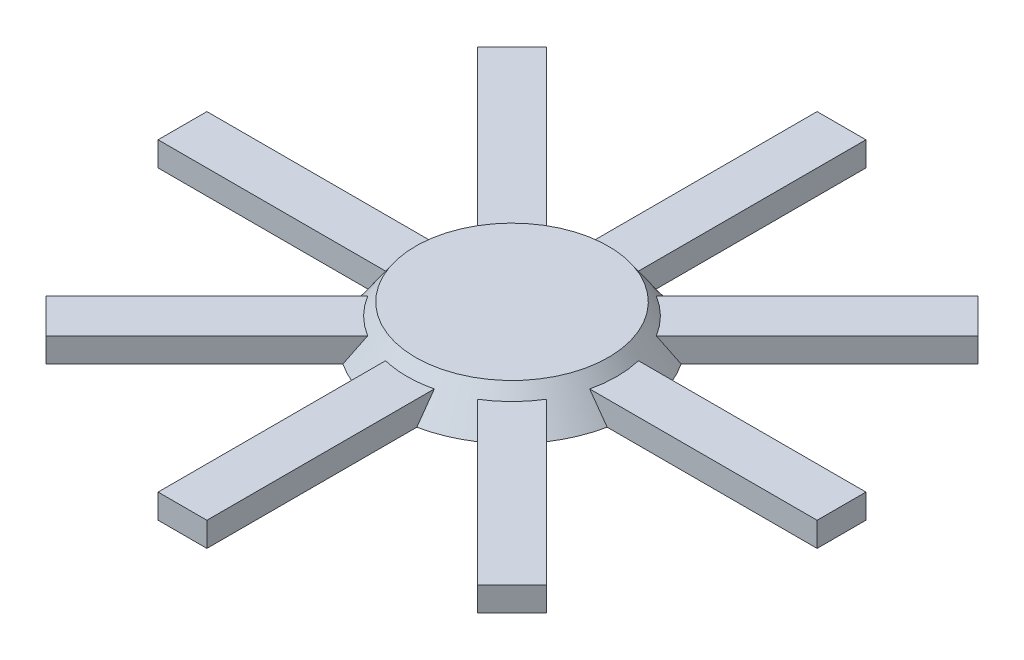
from build123d import *

# Parameters (mm, degrees)
SKETCH_1_R               = 10
EXTRUDE_1_DEPTH          = 3
EXTRUDE_1_TAPER          = 35
SKETCH_2_W               = 4
SKETCH_2_H               = 20
EXTRUDE_2_DEPTH          = 2
PATTERN_CIRCULAR_1_COUNT = 8


with BuildPart() as part:
    # Эскиз1 → Бобышка-Вытянуть1 (new body)
    with BuildSketch(Plane(origin=(0, 0, 0), x_dir=(1, 0, 0), z_dir=(0, 1, 0))):
        Circle(SKETCH_1_R)
    extrude(amount=EXTRUDE_1_DEPTH, taper=EXTRUDE_1_TAPER)

    # Эскиз2 → Бобышка-Вытянуть2 (add)
    with BuildSketch(Plane.XZ):
        with Locations((0, 17)):
            Rectangle(SKETCH_2_W, SKETCH_2_H)
    extrude_2 = extrude(amount=-EXTRUDE_2_DEPTH)

    # Круговой массив1: Бобышка-Вытянуть2 ×8 about axis
    pattern_circular_1_axis = Axis((0, 0, 0), (0, 1, 0))
    for i in range(1, PATTERN_CIRCULAR_1_COUNT):
        add(extrude_2.rotate(pattern_circular_1_axis, i * 360 / PATTERN_CIRCULAR_1_COUNT))


solid = part.part
